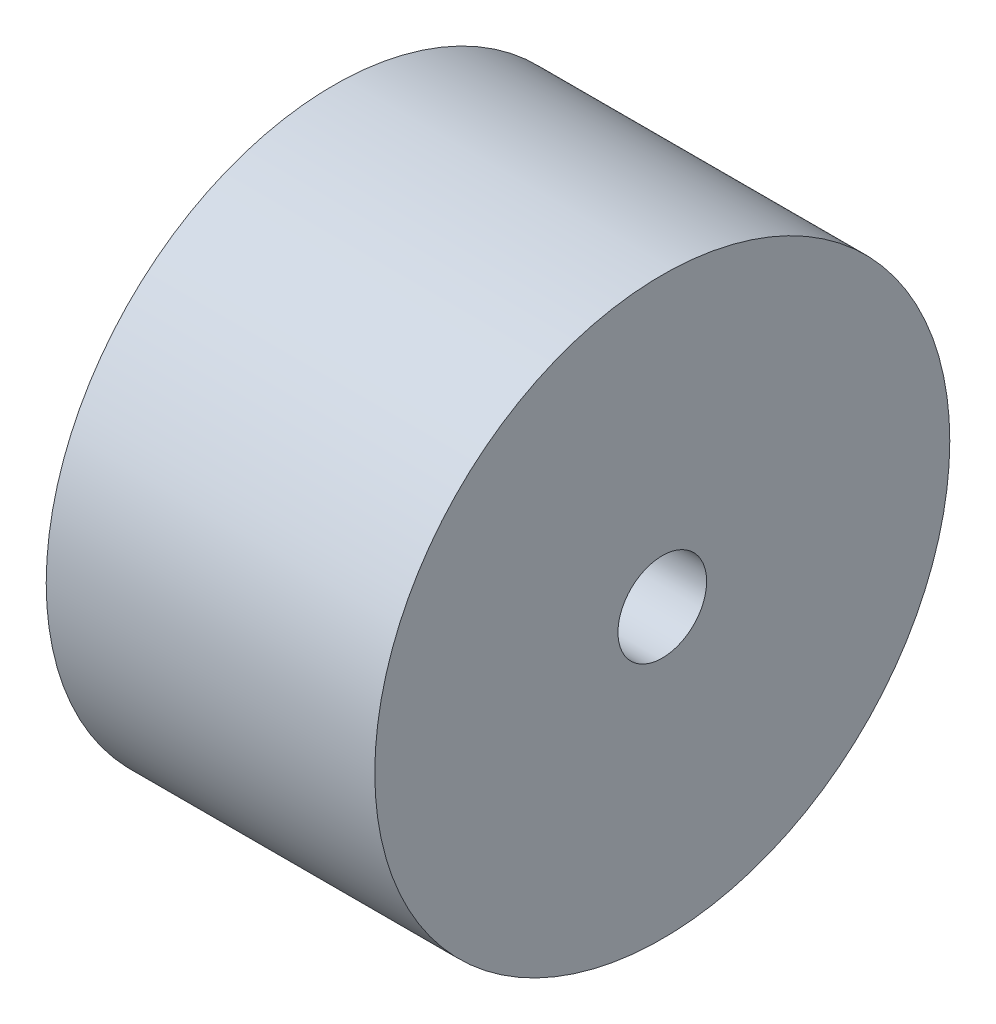
from build123d import *

# Parameters (mm, degrees)
CROQUIS1_R              = 17.5
SALIENTE_EXTRUIR1_DEPTH = 20
CROQUIS2_R              = 2.7
CORTAR_EXTRUIR1_DEPTH   = 32.819805153


with BuildPart() as part:
    # Croquis1 → Saliente-Extruir1 (new body)
    with BuildSketch(Plane(origin=(0, 0, 0), x_dir=(0, 0, -1), z_dir=(1, 0, 0))):
        Circle(CROQUIS1_R)
    extrude(amount=SALIENTE_EXTRUIR1_DEPTH)

    # Croquis2 → Cortar-Extruir1 (cut, through all)
    with BuildSketch(Plane(origin=(20, 0, 0), x_dir=(0, 0, -1), z_dir=(1, 0, 0))):
        Circle(CROQUIS2_R)
    extrude(amount=-CORTAR_EXTRUIR1_DEPTH, mode=Mode.SUBTRACT)


solid = part.part
